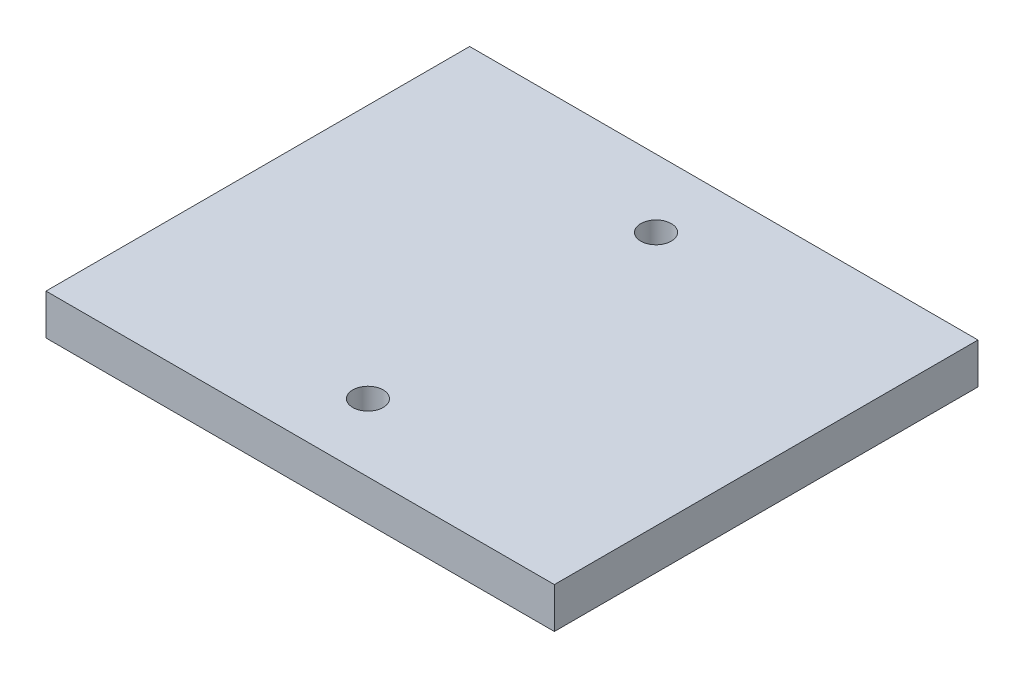
from build123d import *

# Parameters (mm, degrees)
SKETCH1_W           = 150
SKETCH1_H           = 125
SKETCH1_R           = 4.5
BOSS_EXTRUDE1_DEPTH = 12


with BuildPart() as part:
    # Sketch1 → Boss-Extrude1 (new body)
    with BuildSketch(Plane(origin=(0, 0, 0), x_dir=(1, 0, 0), z_dir=(0, 1, 0))):
        Rectangle(SKETCH1_W, SKETCH1_H)
        with Locations(Location((0, 42.5, 0), (0, 0, 270))):
            Circle(SKETCH1_R, mode=Mode.SUBTRACT)
        with Locations(Location((0, -42.5, 0), (0, 0, 270))):
            Circle(SKETCH1_R, mode=Mode.SUBTRACT)
    extrude(amount=BOSS_EXTRUDE1_DEPTH)


solid = part.part
